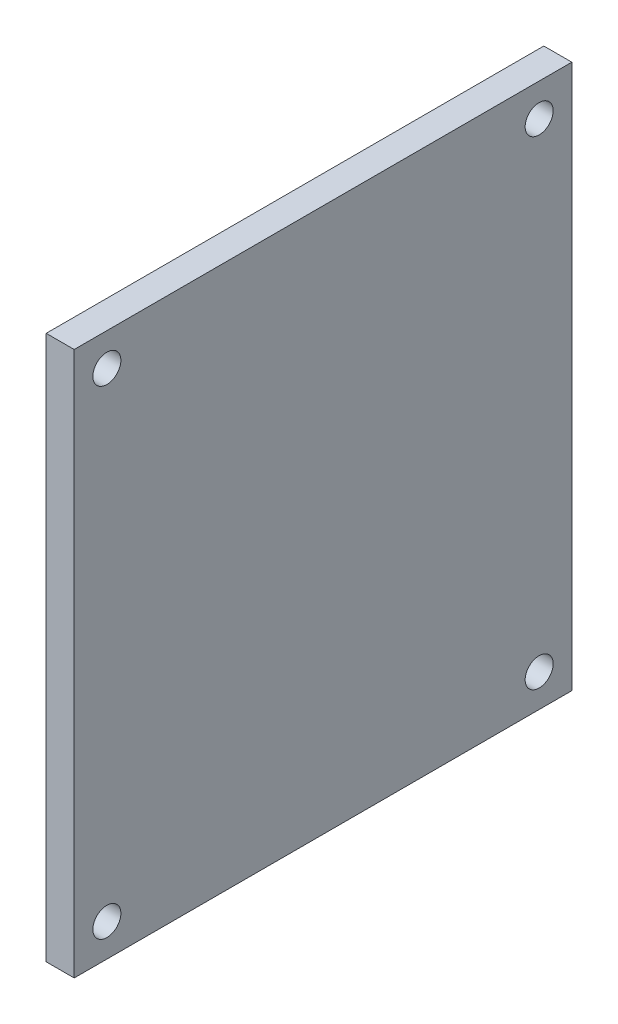
from build123d import *

# Parameters (mm, degrees)
SKETCH2_W             = 53.3
SKETCH2_H             = 58.3
BOSS_EXTRUDE1_DEPTH   = 3
F_3_0MM_DOWEL_HOLE1_D = 3


with BuildPart() as part:
    # Sketch2 → Boss-Extrude1 (new body)
    with BuildSketch(Plane(origin=(0, 0, 0), x_dir=(0, 0, -1), z_dir=(1, 0, 0))):
        with Locations((26.65, 29.15)):
            Rectangle(SKETCH2_W, SKETCH2_H)
    extrude(amount=BOSS_EXTRUDE1_DEPTH)

    # Ø3.0mm Dowel Hole1 (through all)
    with Locations(Plane(origin=(3, 0, 0), x_dir=(0, 0, -1), z_dir=(1, 0, 0))):
        with Locations((3.5, 54.8), (49.8, 54.8), (49.8, 3.5), (3.5, 3.5)):
            Hole(F_3_0MM_DOWEL_HOLE1_D / 2)


solid = part.part
